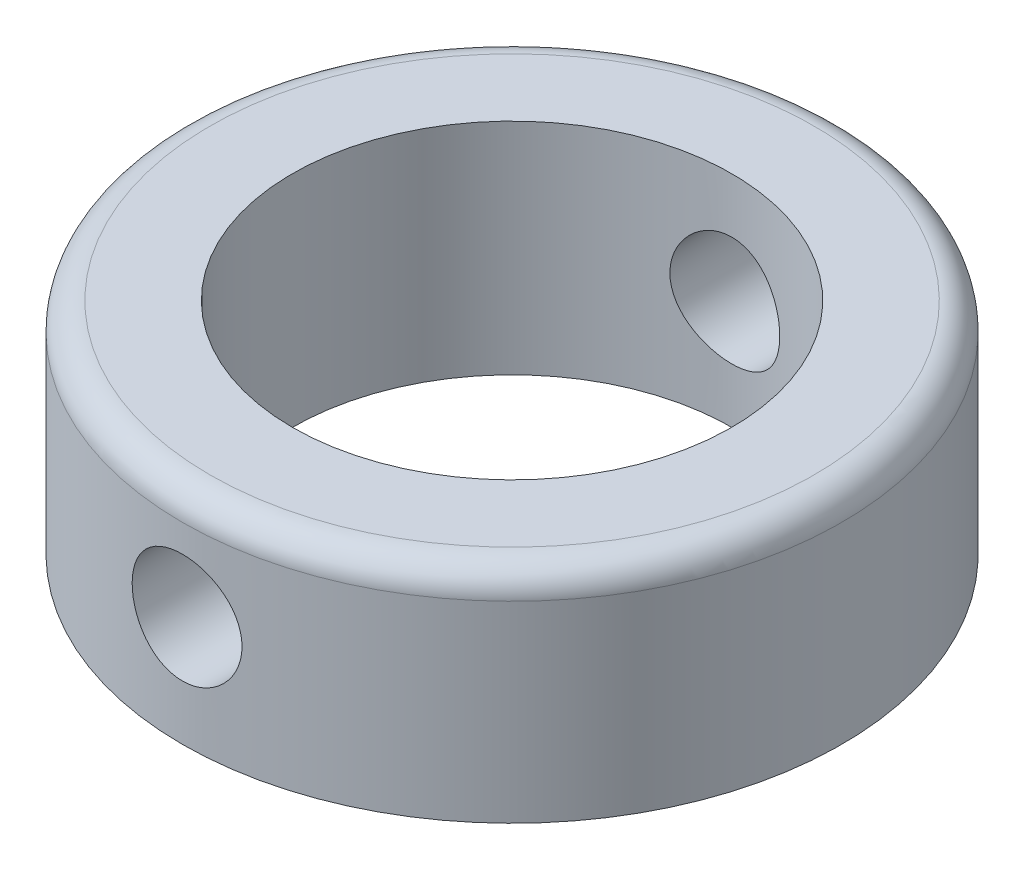
from build123d import *

# Parameters (mm, degrees)
SKETCH1_R               = 12
SKETCH1_R_2             = 8
BOSS_EXTRUDE1_DEPTH     = 8
FILLET1_R               = 1
CUT_EXTRUDE1_DEPTH      = 19.761663039
CUT_EXTRUDE1_DEPTH_BACK = 19.761663039
SKETCH2_R               = 2


with BuildPart() as part:
    # Sketch1 → Boss-Extrude1 (new body)
    with BuildSketch(Plane(origin=(0, 0, 0), x_dir=(1, 0, 0), z_dir=(0, 1, 0))):
        with Locations(Location((0, 0, 0), (0, 0, 270))):
            Circle(SKETCH1_R)
        with Locations(Location((0, 0, 0), (0, 0, 270))):
            Circle(SKETCH1_R_2, mode=Mode.SUBTRACT)
    extrude(amount=BOSS_EXTRUDE1_DEPTH)

    # Fillet1
    fillet1_edges = [part.edges().sort_by_distance(p)[0] for p in [
        (0, 8, -12),
    ]]
    fillet(fillet1_edges, radius=FILLET1_R)

    # Sketch2 → Cut-Extrude1 (cut, two sides: drawn at the far end of the back side and taken through both)
    with BuildSketch(Plane.XY.offset(-CUT_EXTRUDE1_DEPTH_BACK)):
        with Locations((0, 4)):
            Circle(SKETCH2_R)
    extrude(amount=CUT_EXTRUDE1_DEPTH + CUT_EXTRUDE1_DEPTH_BACK, mode=Mode.SUBTRACT)


solid = part.part
